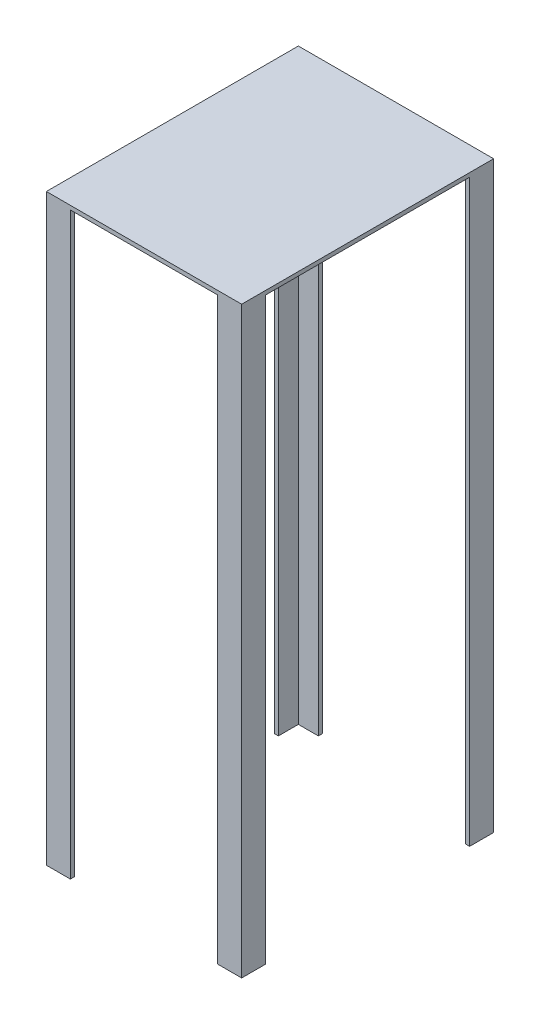
from build123d import *

# Parameters (mm, degrees)
CROQUIS2_W              = 310
CROQUIS2_H              = 400
SALIENTE_EXTRUIR1_DEPTH = 6.35
SALIENTE_EXTRUIR2_DEPTH = 920


with BuildPart() as part:
    # Croquis2 → Saliente-Extruir1 (new body)
    with BuildSketch(Plane(origin=(0, 0, 0), x_dir=(1, 0, 0), z_dir=(0, 1, 0))):
        with Locations((155, 200)):
            Rectangle(CROQUIS2_W, CROQUIS2_H)
    extrude(amount=-SALIENTE_EXTRUIR1_DEPTH)

    # Croquis3 → Saliente-Extruir2 (add)
    with BuildSketch(Plane.XZ.offset(6.35)):
        Polygon((0, 0), (38.1, 0), (38.1, -6.35), (6.35, -6.35), (6.35, -38.1), (0, -38.1), align=None)
        Polygon((303.65, -38.1), (310, -38.1), (310, 0), (271.9, 0), (271.9, -6.35), (303.65, -6.35), align=None)
        Polygon((310, -400), (271.9, -400), (271.9, -393.65), (303.65, -393.65), (303.65, -361.9), (310, -361.9), align=None)
        Polygon((6.35, -361.9), (0, -361.9), (0, -400), (38.1, -400), (38.1, -393.65), (6.35, -393.65), align=None)
    extrude(amount=SALIENTE_EXTRUIR2_DEPTH)


solid = part.part
